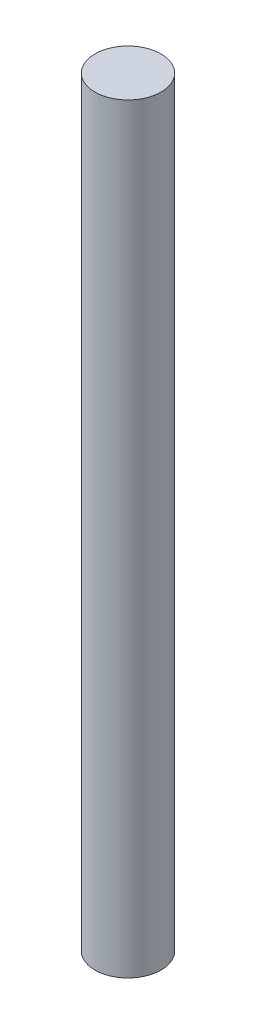
from build123d import *

# Parameters (mm, degrees)
SKETCH1_R           = 5
BOSS_EXTRUDE1_DEPTH = 115


with BuildPart() as part:
    # Sketch1 → Boss-Extrude1 (new body)
    with BuildSketch(Plane(origin=(0, 0, 0), x_dir=(1, 0, 0), z_dir=(0, 1, 0))):
        Circle(SKETCH1_R)
    extrude(amount=BOSS_EXTRUDE1_DEPTH)


solid = part.part
